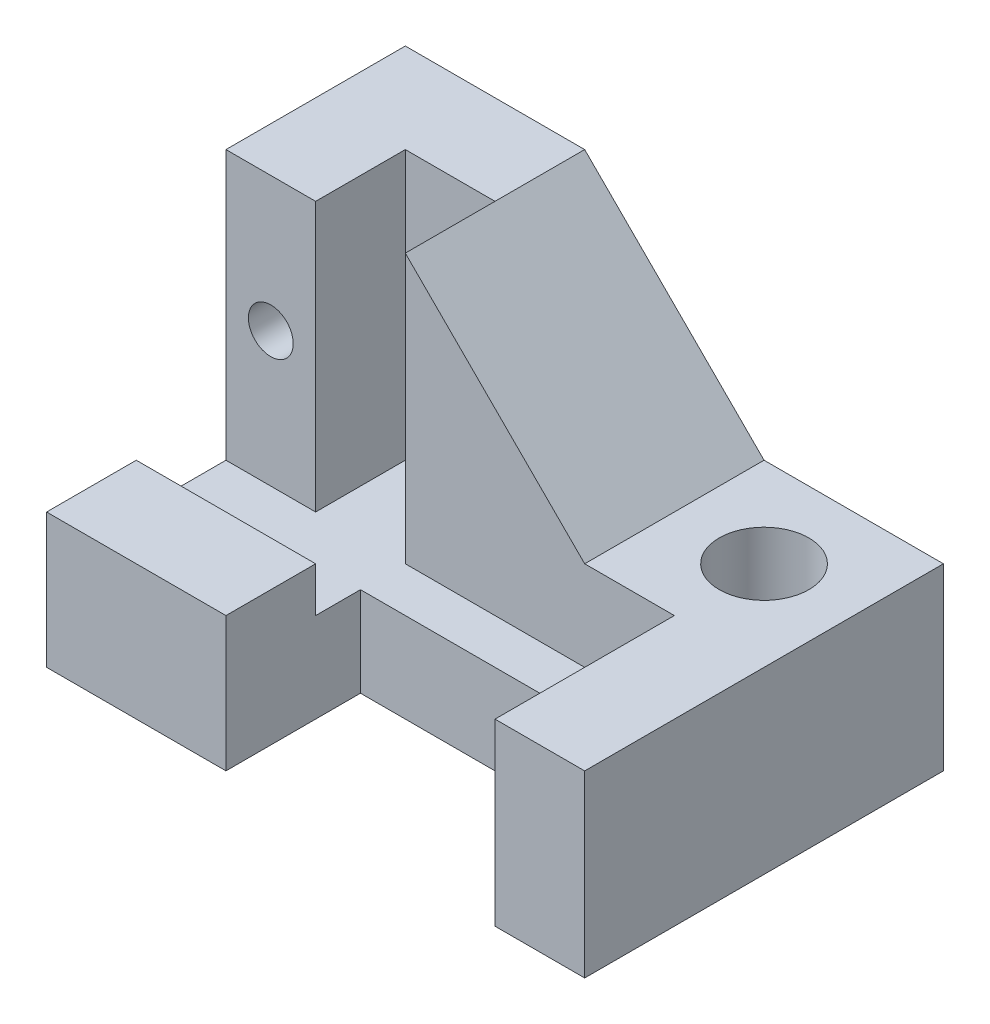
from build123d import *

# Parameters (mm, degrees)
SKETCH1_W               = 3
SKETCH1_H               = 2
BOSS_EXTRUDE1_DEPTH     = 0.5
CUT_EXTRUDE4_DEPTH      = 4.640054945
CUT_EXTRUDE4_DEPTH_BACK = 4.640054945
SKETCH4_6_W             = 1
SKETCH4_6_H             = 0.5
BOSS_EXTRUDE2_DEPTH     = 0.25
BOSS_EXTRUDE3_DEPTH     = 1.5
CUT_EXTRUDE5_DEPTH      = 5.123105626
SKETCH9_R               = 0.25
CUT_EXTRUDE6_DEPTH      = 4.741657387
SKETCH10_R              = 0.125
CUT_EXTRUDE7_DEPTH      = 4.741657387


with BuildPart() as part:
    # Sketch1 → Boss-Extrude1 (new body)
    with BuildSketch(Plane(origin=(0, 0, 0), x_dir=(1, 0, 0), z_dir=(0, 1, 0))):
        with Locations((1.5, 1)):
            Rectangle(SKETCH1_W, SKETCH1_H)
    extrude(amount=BOSS_EXTRUDE1_DEPTH)

    # Sketch4 → Cut-Extrude4 (cut, two sides: drawn at the far end of the back side and taken through both)
    with BuildSketch(Plane(origin=(0, 0.5, 0), x_dir=(1, 0, 0), z_dir=(0, 1, 0)).offset(-CUT_EXTRUDE4_DEPTH_BACK)):
        Polygon((1, 0), (2.5, 0), (2.5, 0.75), (1, 0.75), (1, 0.5), align=None)
    extrude(amount=CUT_EXTRUDE4_DEPTH + CUT_EXTRUDE4_DEPTH_BACK, mode=Mode.SUBTRACT)

    # Sketch4<6> → Boss-Extrude2 (add)
    with BuildSketch(Plane(origin=(0, 0.5, 0), x_dir=(1, 0, 0), z_dir=(0, 1, 0))):
        with Locations((0.5, 0.25)):
            Rectangle(SKETCH4_6_W, SKETCH4_6_H)
    extrude(amount=BOSS_EXTRUDE2_DEPTH)

    # Sketch4<9> → Boss-Extrude3 (add)
    with BuildSketch(Plane(origin=(0, 0.5, 0), x_dir=(1, 0, 0), z_dir=(0, 1, 0))):
        Polygon((0, 2), (0, 1), (0.5, 1), (0.5, 1.5), (1, 1.5), (1, 1), (2.5, 1), (2.5, 0), (3, 0), (3, 2), align=None)
    extrude(amount=BOSS_EXTRUDE3_DEPTH)

    # Sketch8 → Cut-Extrude5 (cut, through all)
    with BuildSketch(Plane.XY):
        Polygon((1, 2), (2, 1), (3, 1), (3, 2), align=None)
    extrude(amount=-CUT_EXTRUDE5_DEPTH, mode=Mode.SUBTRACT)

    # Sketch9 → Cut-Extrude6 (cut, through all)
    with BuildSketch(Plane(origin=(0, 1, 0), x_dir=(1, 0, 0), z_dir=(0, 1, 0))):
        with Locations((2.5, 1.5)):
            Circle(SKETCH9_R)
    extrude(amount=-CUT_EXTRUDE6_DEPTH, mode=Mode.SUBTRACT)

    # Sketch10 → Cut-Extrude7 (cut, through all)
    with BuildSketch(Plane.XY.offset(-1)):
        with Locations((0.25, 1.25)):
            Circle(SKETCH10_R)
    extrude(amount=-CUT_EXTRUDE7_DEPTH, mode=Mode.SUBTRACT)


solid = part.part
